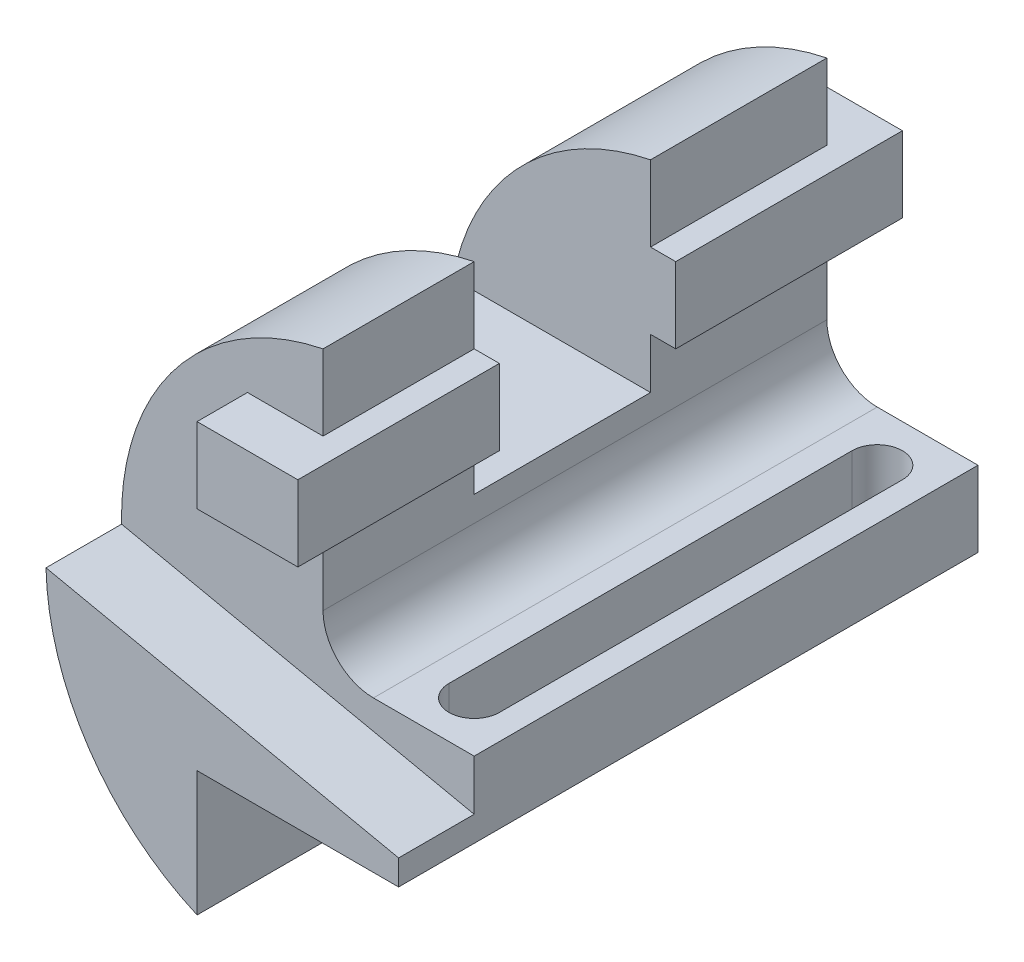
from build123d import *

# Parameters (mm, degrees)
BOSS_EXTRUDE2_DEPTH      = 115
CUT_EXTRUDE1_START       = -15
CUT_EXTRUDE1_DEPTH       = 15
BOSS_EXTRUDE4_DEPTH      = 10
BOSS_EXTRUDE4_DEPTH_BACK = 110
SKETCH4_W                = 20
SKETCH4_H                = 15
CUT_EXTRUDE3_DEPTH       = 141.445719052
CUT_EXTRUDE3_DEPTH_BACK  = 141.445719052
SKETCH5_W                = 35
SKETCH5_H                = 40
CUT_EXTRUDE4_DEPTH       = 146.430395722
CUT_EXTRUDE4_DEPTH_BACK  = 146.430395722
FILLET1_R                = 10


with BuildPart() as part:
    # Sketch1 → Boss-Extrude2 (new body)
    with BuildSketch(Plane.XY):
        with BuildLine():
            Line((0, 0), (0, 15))
            Line((0, 15), (-30, 15))
            Line((-30, 15), (-30, 70))
            ThreePointArc((-30, 70), (-69.724211568, 26.254514819), (-40, -24.815551805))
            Line((-40, -24.815551805), (-40, 0))
            Line((-40, 0), (0, 0))
        make_face()
    extrude(amount=BOSS_EXTRUDE2_DEPTH)

    # Sketch2 → Cut-Extrude1 (cut)
    with BuildSketch(Plane.XY.offset(115).offset(CUT_EXTRUDE1_START)):
        with BuildLine():
            Line((0, 5), (-69.987139252, 19.87622568))
            ThreePointArc((-69.987139252, 19.87622568), (-59.085961763, 52.191731616), (-30, 70))
            Line((-30, 70), (-30, 15))
            Line((-30, 15), (0, 15))
            Line((0, 15), (0, 5))
        make_face()
    extrude(amount=CUT_EXTRUDE1_DEPTH, mode=Mode.SUBTRACT)

    # Sketch4 → Boss-Extrude4 (add, two sides: drawn at the far end of the back side and taken through both)
    with BuildSketch(Plane(origin=(0, 0, 0), x_dir=(-1, 0, 0), z_dir=(0, 0, -1)).offset(-BOSS_EXTRUDE4_DEPTH_BACK)):
        with Locations((35, 47.5)):
            Rectangle(SKETCH4_W, SKETCH4_H)
    extrude(amount=BOSS_EXTRUDE4_DEPTH + BOSS_EXTRUDE4_DEPTH_BACK)

    # Sketch5 → Cut-Extrude3 (cut, two sides: drawn at the far end of the back side and taken through both)
    with BuildSketch(Plane(origin=(-30, 0, 0), x_dir=(0, 0, -1), z_dir=(1, 0, 0)).offset(-CUT_EXTRUDE3_DEPTH_BACK)):
        with Locations((-52.5, 50)):
            Rectangle(SKETCH5_W, SKETCH5_H)
    extrude(amount=CUT_EXTRUDE3_DEPTH + CUT_EXTRUDE3_DEPTH_BACK, mode=Mode.SUBTRACT)

    # Sketch6 → Cut-Extrude4 (cut, two sides: drawn at the far end of the back side and taken through both)
    with BuildSketch(Plane(origin=(0, 15, 0), x_dir=(1, 0, 0), z_dir=(0, 1, 0)).offset(-CUT_EXTRUDE4_DEPTH_BACK)):
        with BuildLine():
            Line((-5, -10), (-5, -90))
            ThreePointArc((-5, -90), (-10, -95), (-15, -90))
            Line((-15, -90), (-15, -10))
            ThreePointArc((-15, -10), (-10, -5), (-5, -10))
        make_face()
    extrude(amount=CUT_EXTRUDE4_DEPTH + CUT_EXTRUDE4_DEPTH_BACK, mode=Mode.SUBTRACT)

    # Fillet1
    fillet1_edges = [part.edges().sort_by_distance(p)[0] for p in [
        (-30, 15, 50),
    ]]
    fillet(fillet1_edges, radius=FILLET1_R)


solid = part.part
